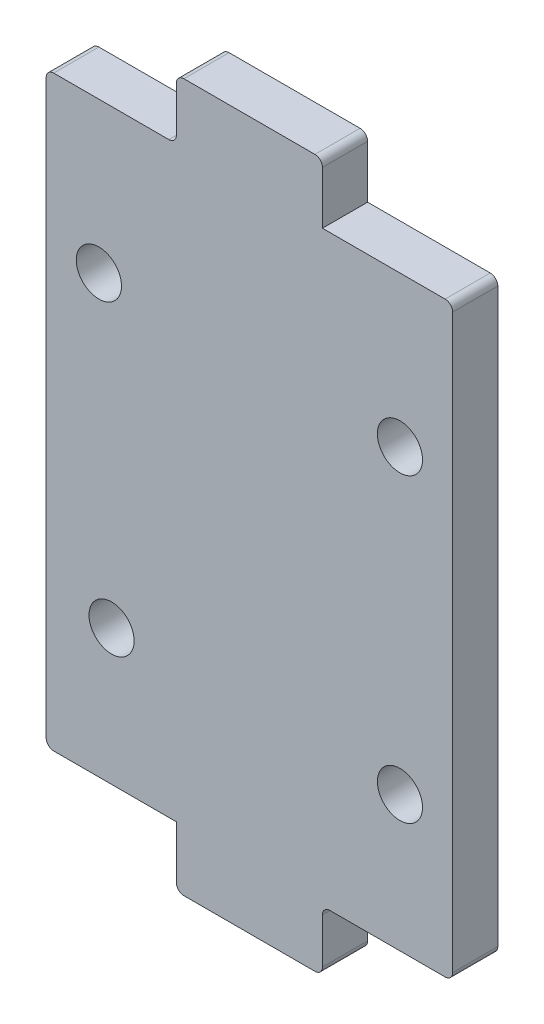
from build123d import *

# Parameters (mm, degrees)
ESQUISSE1_R        = 1.5
BOSS_EXTRU_1_DEPTH = 3
CONG_1_R           = 0.5


with BuildPart() as part:
    # Esquisse1 → Boss.-Extru.1 (new body)
    with BuildSketch(Plane.XY):
        Polygon((-13.5, 19.5), (-4.85133507, 19.5), (-4.85133507, 23.5), (4.85133507, 23.5), (4.85133507, 19.5), (13.5, 19.5), (13.5, -19.5), (4.85133507, -19.5), (4.85133507, -23.5), (-4.85133507, -23.5), (-4.85133507, -19.5), (-13.5, -19.5), align=None)
        with Locations((-10, 9.5)):
            Circle(ESQUISSE1_R, mode=Mode.SUBTRACT)
        with Locations(Location((10, 9.5, 0), (0, 0, 180))):
            Circle(ESQUISSE1_R, mode=Mode.SUBTRACT)
        with Locations((-9.158491979, -10.5)):
            Circle(ESQUISSE1_R, mode=Mode.SUBTRACT)
        with Locations(Location((10, -10.5, 0), (0, 0, 180))):
            Circle(ESQUISSE1_R, mode=Mode.SUBTRACT)
    extrude(amount=BOSS_EXTRU_1_DEPTH)

    # Congé1
    cong_1_edges = [part.edges().sort_by_distance(p)[0] for p in [
        (-13.5, 19.5, 1.5),
        (-4.85133507, 19.5, 1.5),
        (-4.85133507, 23.5, 1.5),
        (4.85133507, 23.5, 1.5),
        (13.5, 19.5, 1.5),
        (13.5, -19.5, 1.5),
        (4.85133507, -19.5, 1.5),
        (4.85133507, -23.5, 1.5),
        (-4.85133507, -23.5, 1.5),
        (-13.5, -19.5, 1.5),
    ]]
    fillet(cong_1_edges, radius=CONG_1_R)


solid = part.part
